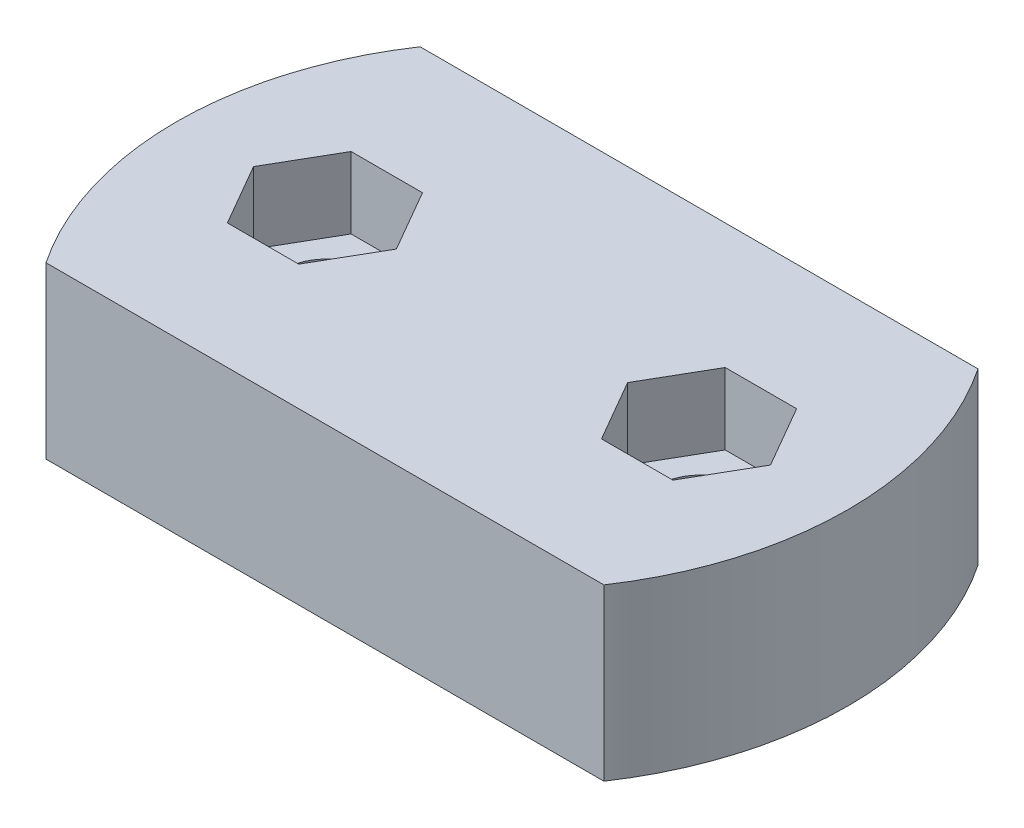
from build123d import *

# Parameters (mm, degrees)
SKETCH1_R             = 19.75
BOSS_EXTRUDE1_DEPTH   = 5
CUT_EXTRUDE1_DEPTH    = 4.2
F_8_CLEARANCE_HOLE1_D = 4.4958
CUT_EXTRUDE2_DEPTH    = 10


with BuildPart() as part:
    # Sketch1 → Boss-Extrude1 (new, symmetric)
    with BuildSketch(Plane(origin=(0, 0, 0), x_dir=(1, 0, 0), z_dir=(0, 1, 0))):
        Circle(SKETCH1_R)
    extrude(amount=BOSS_EXTRUDE1_DEPTH, both=True)

    # Sketch2 → Cut-Extrude1 (cut)
    with BuildSketch(Plane(origin=(0, 5, 0), x_dir=(1, 0, 0), z_dir=(0, 1, 0))):
        Polygon((-8.9, -3.637306696), (-6.8, 0), (-8.9, 3.637306696), (-13.1, 3.637306696), (-15.2, 0), (-13.1, -3.637306696), align=None)
        Polygon((13.1, -3.637306696), (8.9, -3.637306696), (6.8, 0), (8.9, 3.637306696), (13.1, 3.637306696), (15.2, 0), align=None)
    extrude(amount=-CUT_EXTRUDE1_DEPTH, mode=Mode.SUBTRACT)

    # #8 Clearance Hole1 (through all)
    with Locations(Plane(origin=(0, 0.8, 0), x_dir=(1, 0, 0), z_dir=(0, 1, 0))):
        with Locations((-11, 0), (11, 0)):
            Hole(F_8_CLEARANCE_HOLE1_D / 2)

    # Sketch6 → Cut-Extrude2 (cut)
    with BuildSketch(Plane(origin=(0, 5, 0), x_dir=(1, 0, 0), z_dir=(0, 1, 0))):
        with BuildLine():
            ThreePointArc((16.403124702, 11), (0, 19.75), (-16.403124702, 11))
            Line((-16.403124702, 11), (16.403124702, 11))
        make_face()
        with BuildLine():
            Line((16.403124702, -11), (-16.403124702, -11))
            ThreePointArc((-16.403124702, -11), (0, -19.75), (16.403124702, -11))
        make_face()
    extrude(amount=-CUT_EXTRUDE2_DEPTH, mode=Mode.SUBTRACT)


solid = part.part
